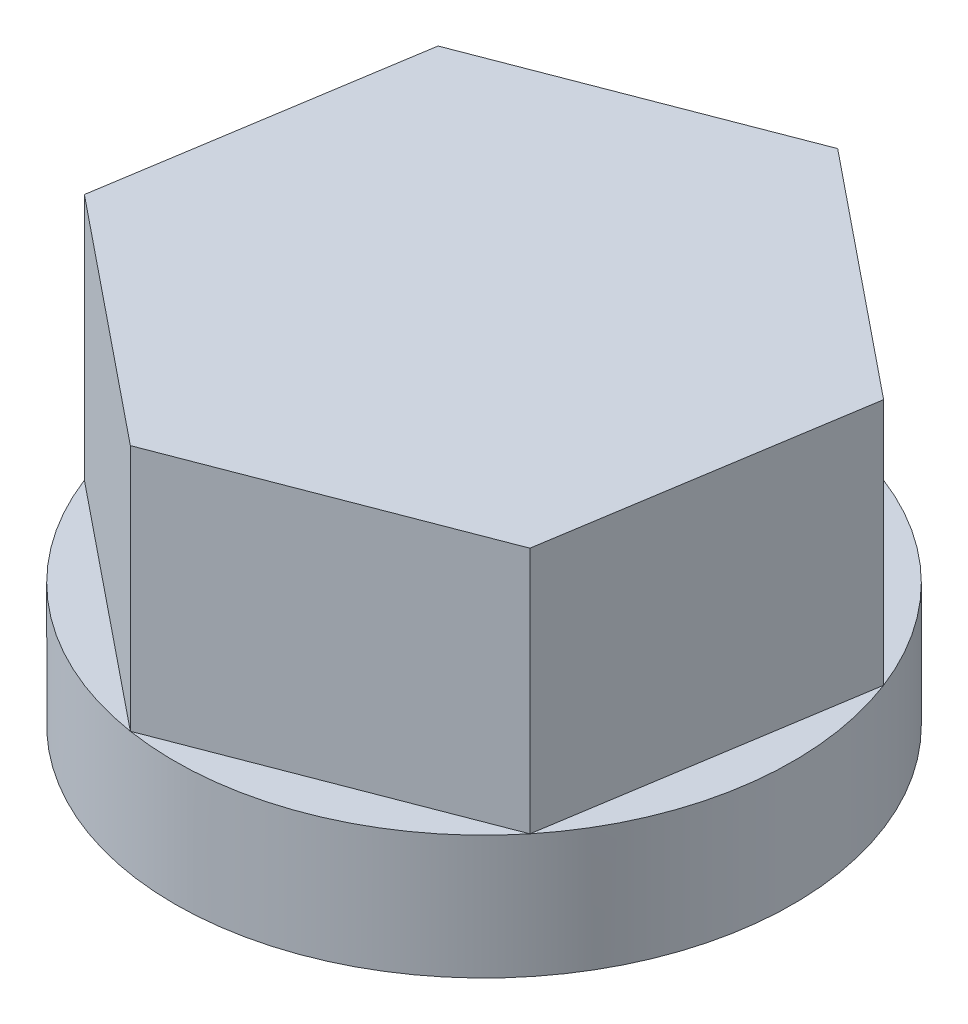
from build123d import *

# Parameters (mm, degrees)
SKETCH_1_R          = 1.25
EXTRUDE_1_DEPTH     = 1.5
SKETCH_2_R          = 0.95
CUT_EXTRUDE_1_DEPTH = 1.2
CUT_EXTRUDE_START   = -1
CUT_EXTRUDE_2_DEPTH = 1


with BuildPart() as part:
    # Эскиз1 → Бобышка-Вытянуть1 (new body)
    with BuildSketch(Plane(origin=(0, 0, 0), x_dir=(1, 0, 0), z_dir=(0, 1, 0))):
        with Locations(Location((0, 0, 0), (0, 0, 270))):
            Circle(SKETCH_1_R)
    extrude(amount=EXTRUDE_1_DEPTH)

    # Эскиз2 → Вырез-Вытянуть1 (cut)
    with BuildSketch(Plane.XZ):
        with Locations(Location((0, 0, 0), (0, 0, 270))):
            Circle(SKETCH_2_R)
    extrude(amount=-CUT_EXTRUDE_1_DEPTH, mode=Mode.SUBTRACT)

    # Эскиз3 → Вырез-Вытянуть2 (cut)
    with BuildSketch(Plane(origin=(0, 1.5, 0), x_dir=(1, 0, 0), z_dir=(0, 1, 0)).offset(CUT_EXTRUDE_START)):
        with BuildLine():
            ThreePointArc((-0.194904913, -1.234711333), (0.44856306, -1.166743837), (0.971838924, -0.786148272))
            Line((0.971838924, -0.786148272), (-0.194904913, -1.234711333))
        make_face()
        with BuildLine():
            ThreePointArc((-1.166743837, -0.44856306), (-0.786148272, -0.971838924), (-0.194904913, -1.234711333))
            Line((-0.194904913, -1.234711333), (-1.166743837, -0.44856306))
        make_face()
        with BuildLine():
            ThreePointArc((-0.971838924, 0.786148272), (-1.234711333, 0.194904913), (-1.166743837, -0.44856306))
            Line((-1.166743837, -0.44856306), (-0.971838924, 0.786148272))
        make_face()
        with BuildLine():
            Line((-0.971838924, 0.786148272), (0.194904913, 1.234711333))
            ThreePointArc((0.194904913, 1.234711333), (-0.44856306, 1.166743837), (-0.971838924, 0.786148272))
        make_face()
        with BuildLine():
            Line((0.194904913, 1.234711333), (1.166743837, 0.44856306))
            ThreePointArc((1.166743837, 0.44856306), (0.786148272, 0.971838924), (0.194904913, 1.234711333))
        make_face()
        with BuildLine():
            Line((1.166743837, 0.44856306), (0.971838924, -0.786148272))
            ThreePointArc((0.971838924, -0.786148272), (1.17840966, -0.416954041), (1.25, 0))
            ThreePointArc((1.25, 0), (1.229009723, 0.228112038), (1.166743837, 0.44856306))
        make_face()
    extrude(amount=CUT_EXTRUDE_2_DEPTH, mode=Mode.SUBTRACT)


solid = part.part
